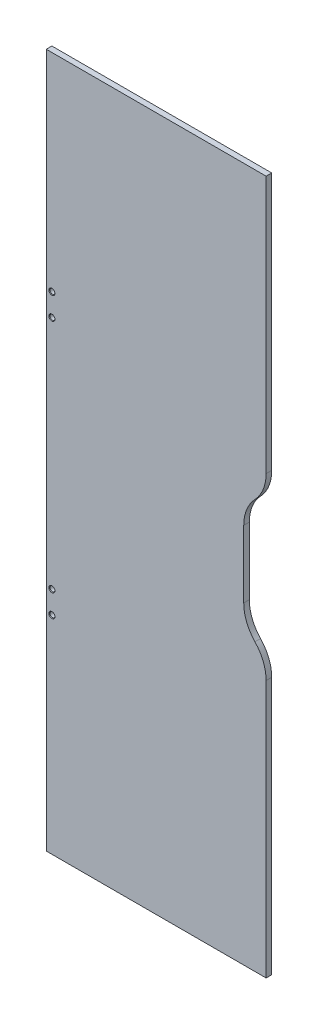
from build123d import *

# Parameters (mm, degrees)
SKETCH1_W                        = 249.301
SKETCH1_H                        = 787.4
BOSS_EXTRUDE1_DEPTH              = 6.35
F_10_CLEARANCE_HOLE1_D           = 5.6134
F_10_CLEARANCE_HOLE1_CSINK_D     = 6.8834
F_10_CLEARANCE_HOLE1_CSINK_ANGLE = 90
CUT_EXTRUDE1_DEPTH               = 840.858019251


with BuildPart() as part:
    # Sketch1 → Boss-Extrude1 (new body)
    with BuildSketch(Plane.XY):
        with Locations((167.4495, 393.7)):
            Rectangle(SKETCH1_W, SKETCH1_H)
    extrude(amount=BOSS_EXTRUDE1_DEPTH)

    # #10 Clearance Hole1 (through all)
    with Locations(Plane.XY.offset(6.35)):
        with Locations((49.149, 552.45), (49.149, 527.05), (49.149, 260.35), (49.149, 234.95)):
            CounterSinkHole(F_10_CLEARANCE_HOLE1_D / 2, F_10_CLEARANCE_HOLE1_CSINK_D / 2, counter_sink_angle=F_10_CLEARANCE_HOLE1_CSINK_ANGLE)

    # Sketch6 → Cut-Extrude1 (cut, through all)
    with BuildSketch(Plane.XY.offset(6.35)):
        with BuildLine():
            Line((292.1, 495.3), (304.8, 495.3))
            Line((304.8, 495.3), (304.8, 292.1))
            Line((304.8, 292.1), (292.1, 292.1))
            ThreePointArc((292.1, 292.1), (288.807245657, 309.197898263), (279.4, 323.85))
            ThreePointArc((279.4, 323.85), (269.992754343, 338.502101737), (266.7, 355.6))
            Line((266.7, 355.6), (266.7, 431.8))
            ThreePointArc((266.7, 431.8), (269.992754343, 448.897898263), (279.4, 463.55))
            ThreePointArc((279.4, 463.55), (288.807245657, 478.202101737), (292.1, 495.3))
        make_face()
    extrude(amount=-CUT_EXTRUDE1_DEPTH, mode=Mode.SUBTRACT)


solid = part.part
